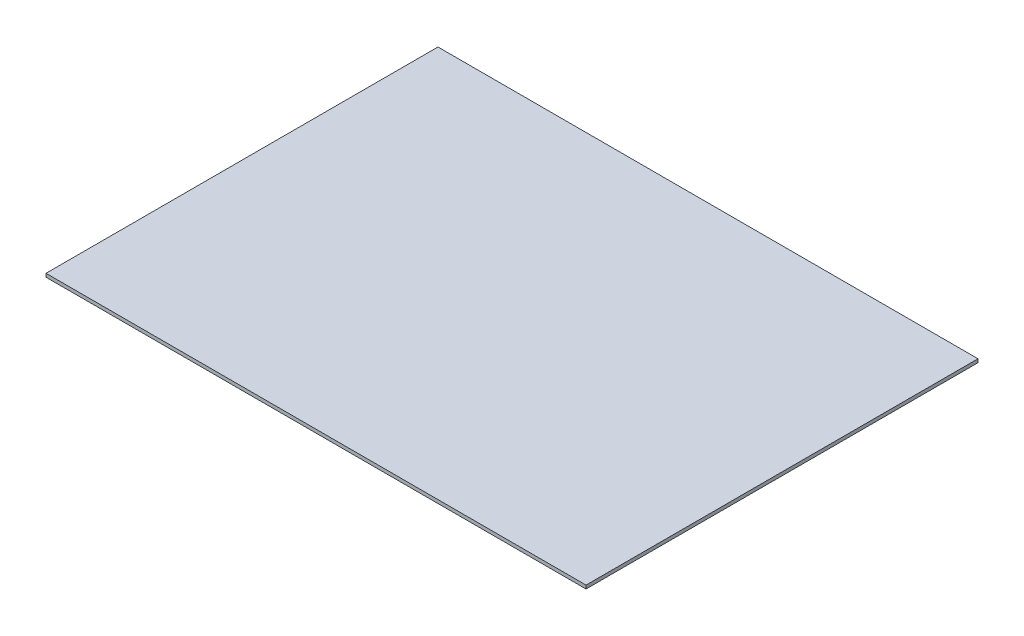
from build123d import *

# Parameters (mm, degrees)
ESQUISSE1_W        = 631
ESQUISSE1_H        = 458
BOSS_EXTRU_1_DEPTH = 4


with BuildPart() as part:
    # Esquisse1 → Boss.-Extru.1 (new body)
    with BuildSketch(Plane(origin=(0, 0, 0), x_dir=(1, 0, 0), z_dir=(0, 1, 0))):
        Rectangle(ESQUISSE1_W, ESQUISSE1_H)
    extrude(amount=BOSS_EXTRU_1_DEPTH)


solid = part.part
